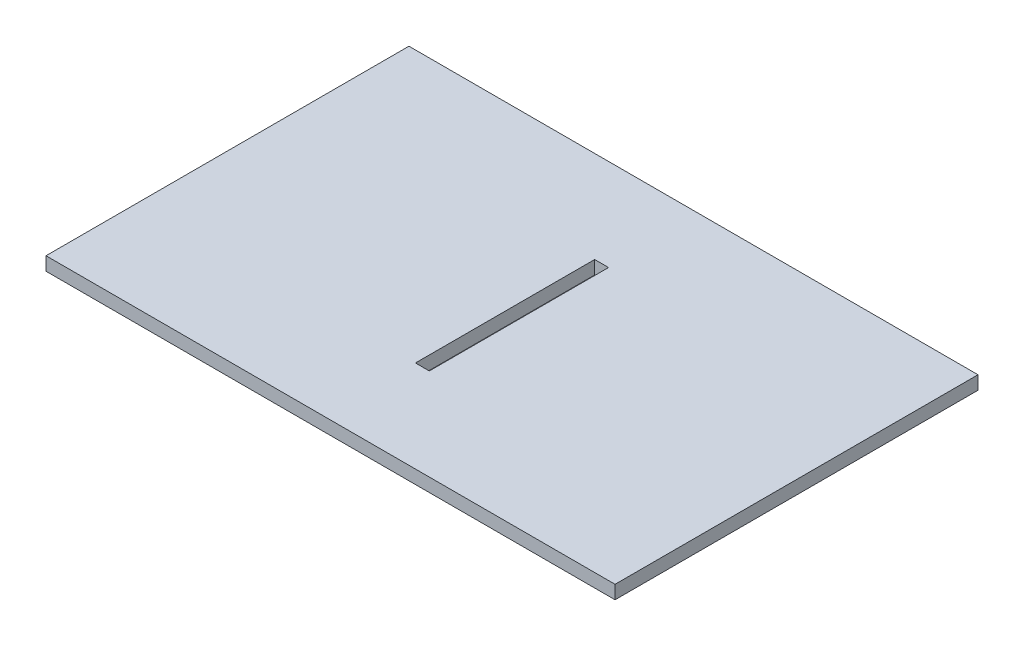
from build123d import *

# Parameters (mm, degrees)
SKETCH1_W           = 63.5
SKETCH1_H           = 40.5
SKETCH1_W_2         = 1.55
SKETCH1_H_2         = 20
BOSS_EXTRUDE1_DEPTH = 1.5


with BuildPart() as part:
    # Sketch1 → Boss-Extrude1 (new body)
    with BuildSketch(Plane(origin=(0, 0, 0), x_dir=(1, 0, 0), z_dir=(0, 1, 0))):
        Rectangle(SKETCH1_W, SKETCH1_H)
        Rectangle(SKETCH1_W_2, SKETCH1_H_2, mode=Mode.SUBTRACT)
    extrude(amount=BOSS_EXTRUDE1_DEPTH)


solid = part.part
